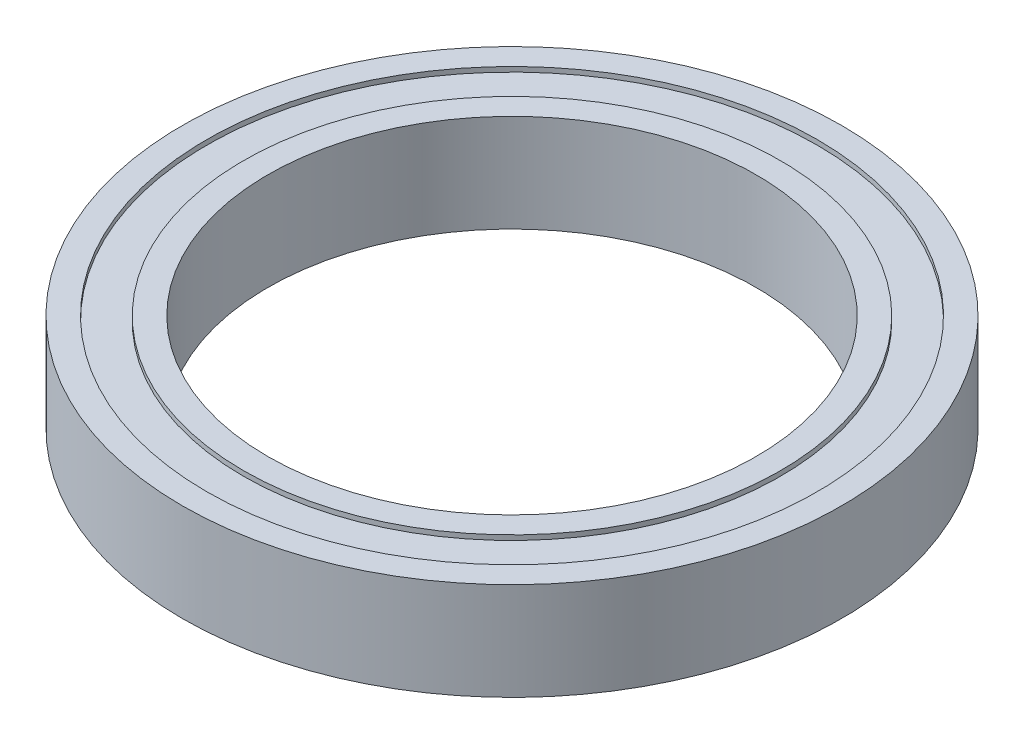
from build123d import *

# Parameters (mm, degrees)
SKETCH1_R           = 13.5
SKETCH1_R_2         = 10
BOSS_EXTRUDE1_DEPTH = 2
CUT_EXTRUDE1_START  = 2
SKETCH2_R           = 12.5
SKETCH2_R_2         = 11
CUT_EXTRUDE1_DEPTH  = 0.2
CUT_EXTRUDE2_START  = -1.8
SKETCH2_2_R         = 12.5
SKETCH2_2_R_2       = 11
CUT_EXTRUDE2_DEPTH  = 0.2


with BuildPart() as part:
    # Sketch1 → Boss-Extrude1 (new, symmetric)
    with BuildSketch(Plane(origin=(0, 0, 0), x_dir=(1, 0, 0), z_dir=(0, 1, 0))):
        with Locations(Location((0, 0, 0), (0, 0, 270))):
            Circle(SKETCH1_R)
        with Locations(Location((0, 0, 0), (0, 0, 270))):
            Circle(SKETCH1_R_2, mode=Mode.SUBTRACT)
    extrude(amount=BOSS_EXTRUDE1_DEPTH, both=True)

    # Sketch2 → Cut-Extrude1 (cut)
    with BuildSketch(Plane.XZ.offset(CUT_EXTRUDE1_START)):
        with Locations(Location((0, 0, 0), (0, 0, 90))):
            Circle(SKETCH2_R)
        with Locations(Location((0, 0, 0), (0, 0, 90))):
            Circle(SKETCH2_R_2, mode=Mode.SUBTRACT)
    extrude(amount=-CUT_EXTRUDE1_DEPTH, mode=Mode.SUBTRACT)

    # Sketch2<2> → Cut-Extrude2 (cut)
    with BuildSketch(Plane.XZ.offset(CUT_EXTRUDE2_START)):
        with Locations(Location((0, 0, 0), (0, 0, 90))):
            Circle(SKETCH2_2_R)
        with Locations(Location((0, 0, 0), (0, 0, 90))):
            Circle(SKETCH2_2_R_2, mode=Mode.SUBTRACT)
    extrude(amount=-CUT_EXTRUDE2_DEPTH, mode=Mode.SUBTRACT)


solid = part.part
